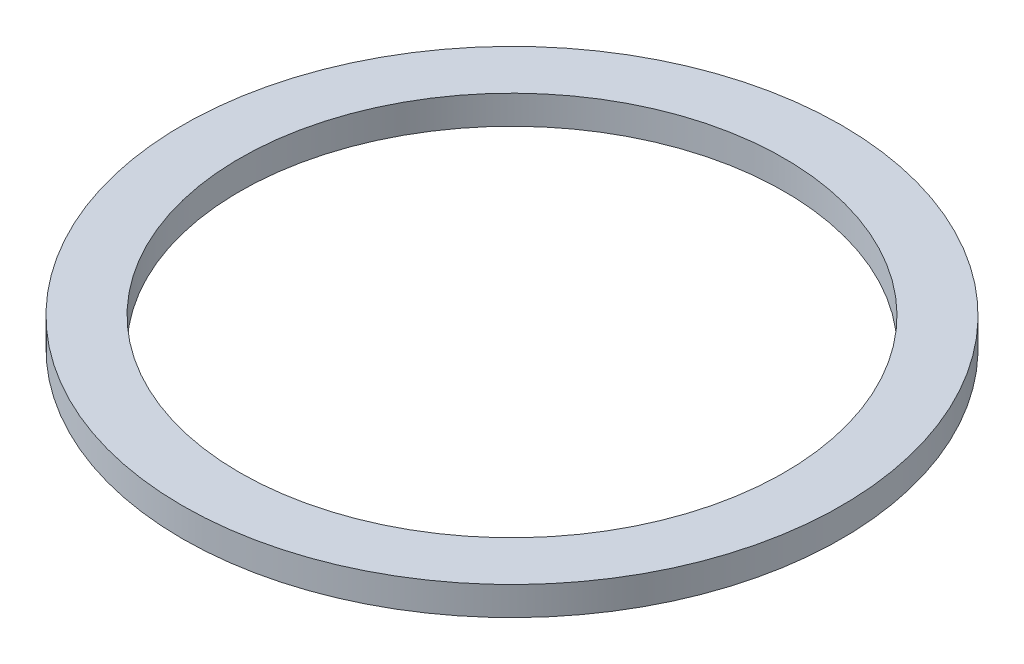
from build123d import *

# Parameters (mm, degrees)
SKETCH1_R           = 57.5
SKETCH1_R_2         = 47.5
BOSS_EXTRUDE1_DEPTH = 2.5


with BuildPart() as part:
    # Sketch1 → Boss-Extrude1 (new, symmetric)
    with BuildSketch(Plane(origin=(0, 0, 0), x_dir=(1, 0, 0), z_dir=(0, 1, 0))):
        with Locations(Location((0, 0, 0), (0, 0, 270))):
            Circle(SKETCH1_R)
        with Locations(Location((0, 0, 0), (0, 0, 270))):
            Circle(SKETCH1_R_2, mode=Mode.SUBTRACT)
    extrude(amount=BOSS_EXTRUDE1_DEPTH, both=True)


solid = part.part
